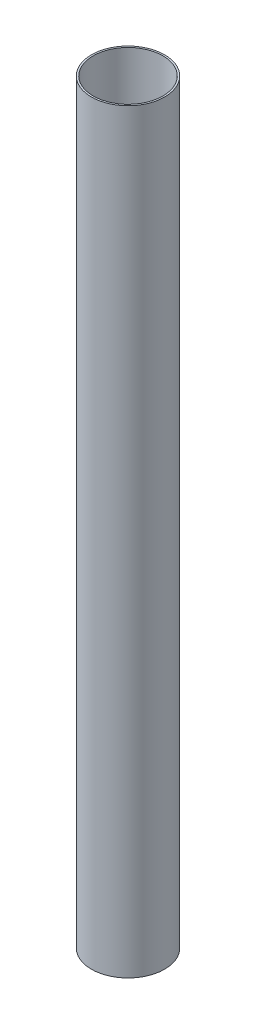
from build123d import *

# Parameters (mm, degrees)
SKETCH1_R           = 69.5071
SKETCH1_R_2         = 66.1924
BOSS_EXTRUDE1_DEPTH = 1434.592


with BuildPart() as part:
    # Sketch1 → Boss-Extrude1 (new body)
    with BuildSketch(Plane(origin=(0, 114.3, 0), x_dir=(1, 0, 0), z_dir=(0, 1, 0))):
        Circle(SKETCH1_R)
        Circle(SKETCH1_R_2, mode=Mode.SUBTRACT)
    extrude(amount=BOSS_EXTRUDE1_DEPTH)


solid = part.part
